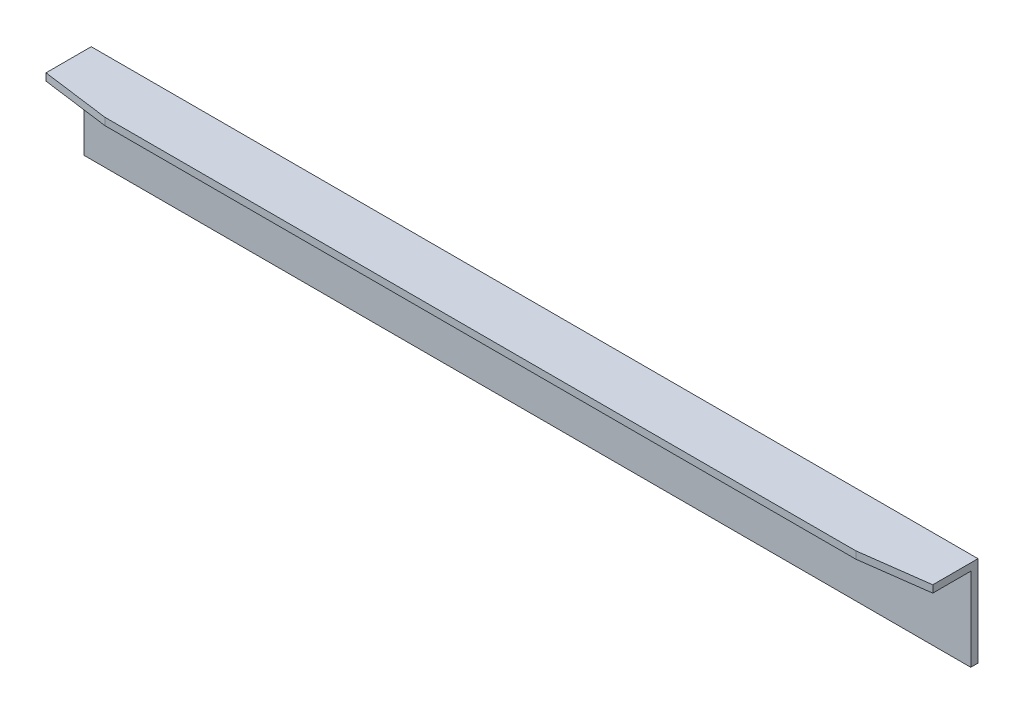
from build123d import *

# Parameters (mm, degrees)
SKETCH_1_W          = 1960
SKETCH_1_H          = 200
EXTRUDE_1447_DEPTH  = 16
SKETCH_2_W          = 1960
SKETCH_2_H          = 16
EXTRUDE_1_DEPTH     = 104
CUT_EXTRUDE_1_DEPTH = 1008.372820757


with BuildPart() as part:
    # 草图1 → Extrude 1447 (new body)
    with BuildSketch(Plane.XY):
        with Locations((0, 100)):
            Rectangle(SKETCH_1_W, SKETCH_1_H)
    extrude(amount=EXTRUDE_1447_DEPTH)

    # 草图2 → 凸台-拉伸1 (add)
    with BuildSketch(Plane.XY.offset(16)):
        with Locations((0, 192)):
            Rectangle(SKETCH_2_W, SKETCH_2_H)
    extrude(amount=EXTRUDE_1_DEPTH)

    # 草图3 → 切除-拉伸1 (cut, through all)
    with BuildSketch(Plane(origin=(0, 200, 0), x_dir=(-1, 0, 0), z_dir=(0, 1, 0))):
        Polygon((-980, 100), (-830, 120), (-980, 120), align=None)
        Polygon((980, 100), (830, 120), (980, 120), align=None)
    extrude(amount=-CUT_EXTRUDE_1_DEPTH, mode=Mode.SUBTRACT)


solid = part.part
